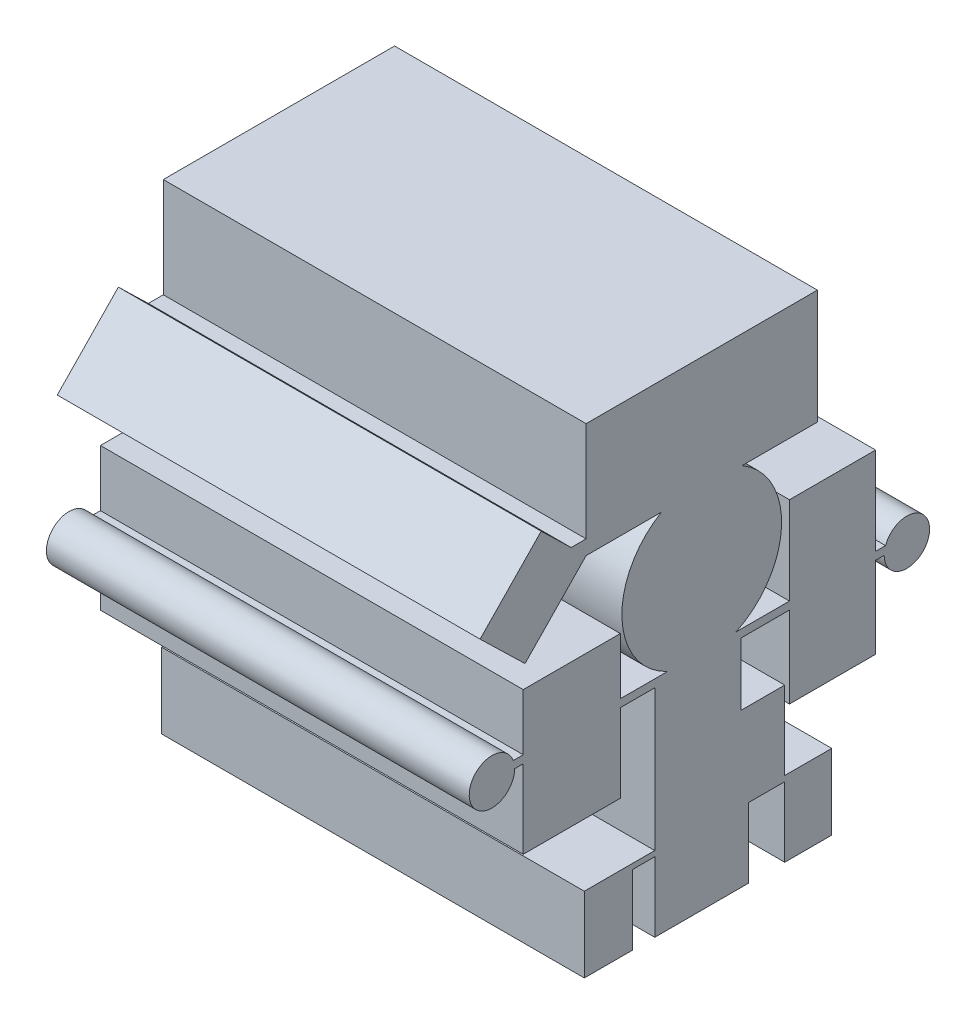
from build123d import *

# Parameters (mm, degrees)
BOSS_EXTRUDE1_DEPTH = 685.8


with BuildPart() as part:
    # Sketch1 → Boss-Extrude1 (new body)
    with BuildSketch(Plane(origin=(0, 0, 0), x_dir=(0, 0, -1), z_dir=(1, 0, 0))):
        with BuildLine():
            Line((-112.268, 0), (-190.5, 0))
            Line((-190.5, 0), (-190.5, 121.92))
            Line((-190.5, 121.92), (-112.268, 121.92))
            Line((-112.268, 121.92), (-76.2, 121.92))
            Line((-76.2, 121.92), (-76.2, 248.92))
            Line((-76.2, 248.92), (-76.2, 350.52))
            Line((-76.2, 350.52), (-132.08, 350.52))
            Line((-132.08, 350.52), (-132.08, 223.266))
            Line((-132.08, 223.266), (-289.56, 223.266))
            Line((-289.56, 223.266), (-289.56, 350.52))
            Line((-289.56, 350.52), (-303.53, 350.52))
            ThreePointArc((-303.53, 350.52), (-376.632349663, 344.135209485), (-305.743714359, 363.096234269))
            Line((-305.743714359, 363.096234269), (-289.56, 363.096234269))
            Line((-289.56, 363.096234269), (-289.56, 454.66))
            Line((-289.56, 454.66), (-132.08, 454.66))
            Line((-132.08, 454.66), (-132.08, 363.096234269))
            Line((-132.08, 363.096234269), (-55.678443819, 363.096234269))
            ThreePointArc((-55.678443819, 363.096234269), (-129.420723475, 474.502308473), (-65.500488548, 591.82))
            Line((-65.500488548, 591.82), (-187.579, 591.82))
            Line((-187.579, 591.82), (-286.645657648, 489.751322423))
            Line((-286.645657648, 489.751322423), (-359.551855918, 560.513220743))
            Line((-359.551855918, 560.513220743), (-260.485198269, 662.58189832))
            Line((-260.485198269, 662.58189832), (-211.832451768, 615.360114952))
            Line((-211.832451768, 615.360114952), (-187.579, 615.360114952))
            Line((-187.579, 615.360114952), (-187.579, 777.24))
            Line((-187.579, 777.24), (187.579, 777.24))
            Line((187.579, 777.24), (187.579, 591.82))
            Line((187.579, 591.82), (65.500488548, 591.82))
            ThreePointArc((65.500488548, 591.82), (129.420723475, 474.502308473), (55.678443819, 363.096234269))
            Line((55.678443819, 363.096234269), (142.24, 363.096234269))
            Line((142.24, 363.096234269), (142.24, 505.46))
            Line((142.24, 505.46), (281.94, 505.46))
            Line((281.94, 505.46), (281.94, 363.096234269))
            Line((281.94, 363.096234269), (298.123714359, 363.096234269))
            ThreePointArc((298.123714359, 363.096234269), (369.012349663, 344.135209485), (295.91, 350.52))
            Line((295.91, 350.52), (281.94, 350.52))
            Line((281.94, 350.52), (281.94, 218.44))
            Line((281.94, 218.44), (142.24, 218.44))
            Line((142.24, 218.44), (142.24, 350.52))
            Line((142.24, 350.52), (63.5, 350.52))
            Line((63.5, 350.52), (63.5, 248.92))
            Line((63.5, 248.92), (134.62, 248.92))
            Line((134.62, 248.92), (134.62, 121.92))
            Line((134.62, 121.92), (210.82, 121.92))
            Line((210.82, 121.92), (210.82, 0))
            Line((210.82, 0), (134.62, 0))
            Line((134.62, 0), (134.62, 113.239883031))
            Line((134.62, 113.239883031), (76.2, 113.239883031))
            Line((76.2, 113.239883031), (76.2, 0))
            Line((76.2, 0), (-76.2, 0))
            Line((-76.2, 0), (-76.2, 113.239883031))
            Line((-76.2, 113.239883031), (-112.268, 113.239883031))
            Line((-112.268, 113.239883031), (-112.268, 0))
        make_face()
    extrude(amount=BOSS_EXTRUDE1_DEPTH)


solid = part.part
